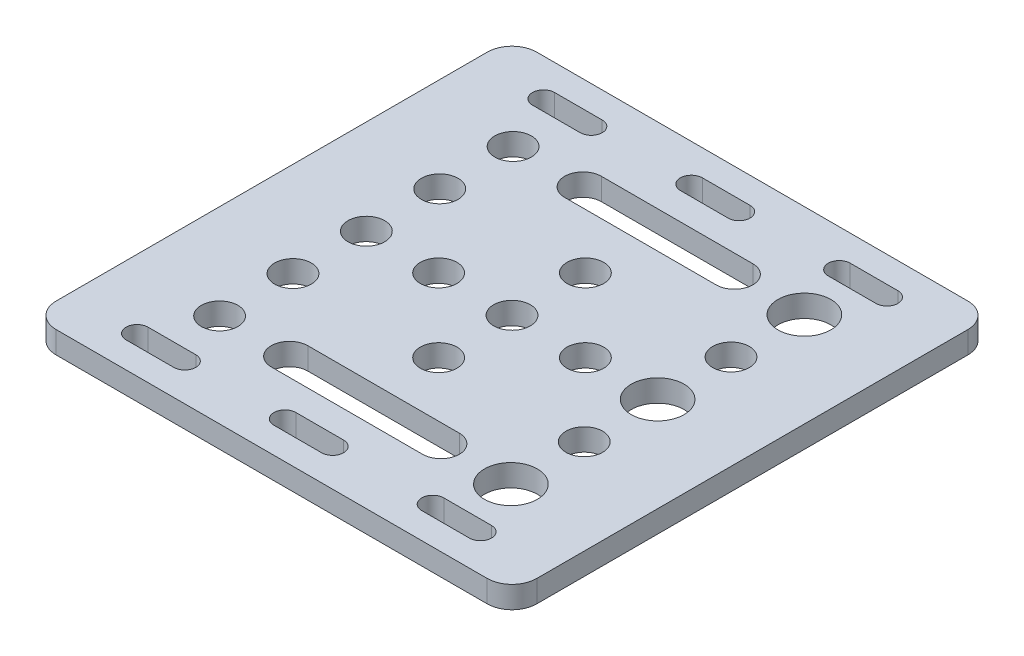
from build123d import *

# Parameters (mm, degrees)
SKETCH1_R           = 3.6
SKETCH1_R_2         = 2.5
BOSS_EXTRUDE1_DEPTH = 3


with BuildPart() as part:
    # Sketch1 → Boss-Extrude1 (new body)
    with BuildSketch(Plane(origin=(0, 0, 0), x_dir=(1, 0, 0), z_dir=(0, 1, 0))):
        with BuildLine():
            Line((-32.75, 29.37), (-32.75, -29.37))
            ThreePointArc((-32.75, -29.37), (-31.76002092, -31.76002092), (-29.37, -32.75))
            Line((-29.37, -32.75), (29.37, -32.75))
            ThreePointArc((29.37, -32.75), (31.76002092, -31.76002092), (32.75, -29.37))
            Line((32.75, -29.37), (32.75, 29.37))
            ThreePointArc((32.75, 29.37), (31.76002092, 31.76002092), (29.37, 32.75))
            Line((29.37, 32.75), (-29.37, 32.75))
            ThreePointArc((-29.37, 32.75), (-31.76002092, 31.76002092), (-32.75, 29.37))
        make_face()
        with Locations(Location((19.85, -20, 0), (0, 0, 90))):
            Circle(SKETCH1_R, mode=Mode.SUBTRACT)
        with Locations(Location((19.85, 0, 0), (0, 0, 90))):
            Circle(SKETCH1_R, mode=Mode.SUBTRACT)
        with Locations(Location((19.85, 10, 0), (0, 0, 90))):
            Circle(SKETCH1_R_2, mode=Mode.SUBTRACT)
        with Locations(Location((-19.85, 10, 0), (0, 0, 90))):
            Circle(SKETCH1_R_2, mode=Mode.SUBTRACT)
        with Locations(Location((-19.85, -10, 0), (0, 0, 90))):
            Circle(SKETCH1_R_2, mode=Mode.SUBTRACT)
        with Locations(Location((10, 0, 0), (0, 0, 90))):
            Circle(SKETCH1_R_2, mode=Mode.SUBTRACT)
        with Locations(Location((-10, 0, 0), (0, 0, 90))):
            Circle(SKETCH1_R_2, mode=Mode.SUBTRACT)
        with Locations(Location((0, 0, 0), (0, 0, 90))):
            Circle(SKETCH1_R_2, mode=Mode.SUBTRACT)
        with Locations(Location((0, 10, 0), (0, 0, 90))):
            Circle(SKETCH1_R_2, mode=Mode.SUBTRACT)
        with Locations(Location((0, -10, 0), (0, 0, 90))):
            Circle(SKETCH1_R_2, mode=Mode.SUBTRACT)
        with Locations(Location((-19.85, 0, 0), (0, 0, 90))):
            Circle(SKETCH1_R_2, mode=Mode.SUBTRACT)
        with Locations(Location((-19.85, -20, 0), (0, 0, 90))):
            Circle(SKETCH1_R_2, mode=Mode.SUBTRACT)
        with Locations(Location((-19.85, 20, 0), (0, 0, 90))):
            Circle(SKETCH1_R_2, mode=Mode.SUBTRACT)
        with Locations(Location((19.85, -10, 0), (0, 0, 90))):
            Circle(SKETCH1_R_2, mode=Mode.SUBTRACT)
        with Locations(Location((19.85, 20, 0), (0, 0, 90))):
            Circle(SKETCH1_R, mode=Mode.SUBTRACT)
        with BuildLine():
            Line((-10.32, 22.5), (10.32, 22.5))
            ThreePointArc((10.32, 22.5), (12.82, 20), (10.32, 17.5))
            Line((10.32, 17.5), (-10.32, 17.5))
            ThreePointArc((-10.32, 17.5), (-12.82, 20), (-10.32, 22.5))
        make_face(mode=Mode.SUBTRACT)
        with BuildLine():
            Line((23.4, 26.2), (16.9, 26.2))
            ThreePointArc((16.9, 26.2), (15.4, 27.7), (16.9, 29.2))
            Line((16.9, 29.2), (23.4, 29.2))
            ThreePointArc((23.4, 29.2), (24.9, 27.7), (23.4, 26.2))
        make_face(mode=Mode.SUBTRACT)
        with BuildLine():
            Line((-23.4, 29.2), (-16.9, 29.2))
            ThreePointArc((-16.9, 29.2), (-15.4, 27.7), (-16.9, 26.2))
            Line((-16.9, 26.2), (-23.4, 26.2))
            ThreePointArc((-23.4, 26.2), (-24.9, 27.7), (-23.4, 29.2))
        make_face(mode=Mode.SUBTRACT)
        with BuildLine():
            Line((16.9, -26.2), (23.4, -26.2))
            ThreePointArc((23.4, -26.2), (24.9, -27.7), (23.4, -29.2))
            Line((23.4, -29.2), (16.9, -29.2))
            ThreePointArc((16.9, -29.2), (15.4, -27.7), (16.9, -26.2))
        make_face(mode=Mode.SUBTRACT)
        with BuildLine():
            Line((3.25, -29.2), (-3.25, -29.2))
            ThreePointArc((-3.25, -29.2), (-4.75, -27.7), (-3.25, -26.2))
            Line((-3.25, -26.2), (3.25, -26.2))
            ThreePointArc((3.25, -26.2), (4.75, -27.7), (3.25, -29.2))
        make_face(mode=Mode.SUBTRACT)
        with BuildLine():
            Line((-23.4, -26.2), (-16.9, -26.2))
            ThreePointArc((-16.9, -26.2), (-15.4, -27.7), (-16.9, -29.2))
            Line((-16.9, -29.2), (-23.4, -29.2))
            ThreePointArc((-23.4, -29.2), (-24.9, -27.7), (-23.4, -26.2))
        make_face(mode=Mode.SUBTRACT)
        with BuildLine():
            Line((3.25, 26.2), (-3.25, 26.2))
            ThreePointArc((-3.25, 26.2), (-4.75, 27.7), (-3.25, 29.2))
            Line((-3.25, 29.2), (3.25, 29.2))
            ThreePointArc((3.25, 29.2), (4.75, 27.7), (3.25, 26.2))
        make_face(mode=Mode.SUBTRACT)
        with BuildLine():
            Line((10.32, -22.5), (-10.32, -22.5))
            ThreePointArc((-10.32, -22.5), (-12.82, -20), (-10.32, -17.5))
            Line((-10.32, -17.5), (10.32, -17.5))
            ThreePointArc((10.32, -17.5), (12.82, -20), (10.32, -22.5))
        make_face(mode=Mode.SUBTRACT)
    extrude(amount=BOSS_EXTRUDE1_DEPTH)


solid = part.part
